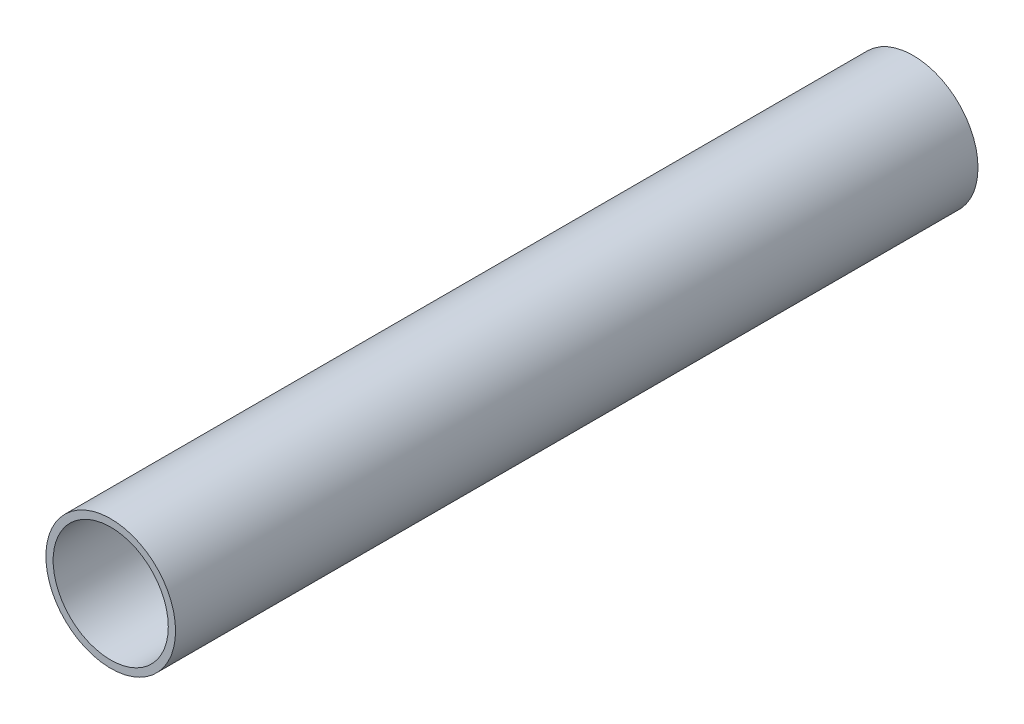
from build123d import *

# Parameters (mm, degrees)
SKETCH1_R           = 7.9375
SKETCH1_R_2         = 7.0485
BOSS_EXTRUDE1_DEPTH = 98.24


with BuildPart() as part:
    # Sketch1 → Boss-Extrude1 (new body)
    with BuildSketch(Plane.XY):
        with Locations((0.56942311, -0.711778887)):
            Circle(SKETCH1_R)
        with Locations((0.56942311, -0.711778887)):
            Circle(SKETCH1_R_2, mode=Mode.SUBTRACT)
    extrude(amount=BOSS_EXTRUDE1_DEPTH)


solid = part.part
